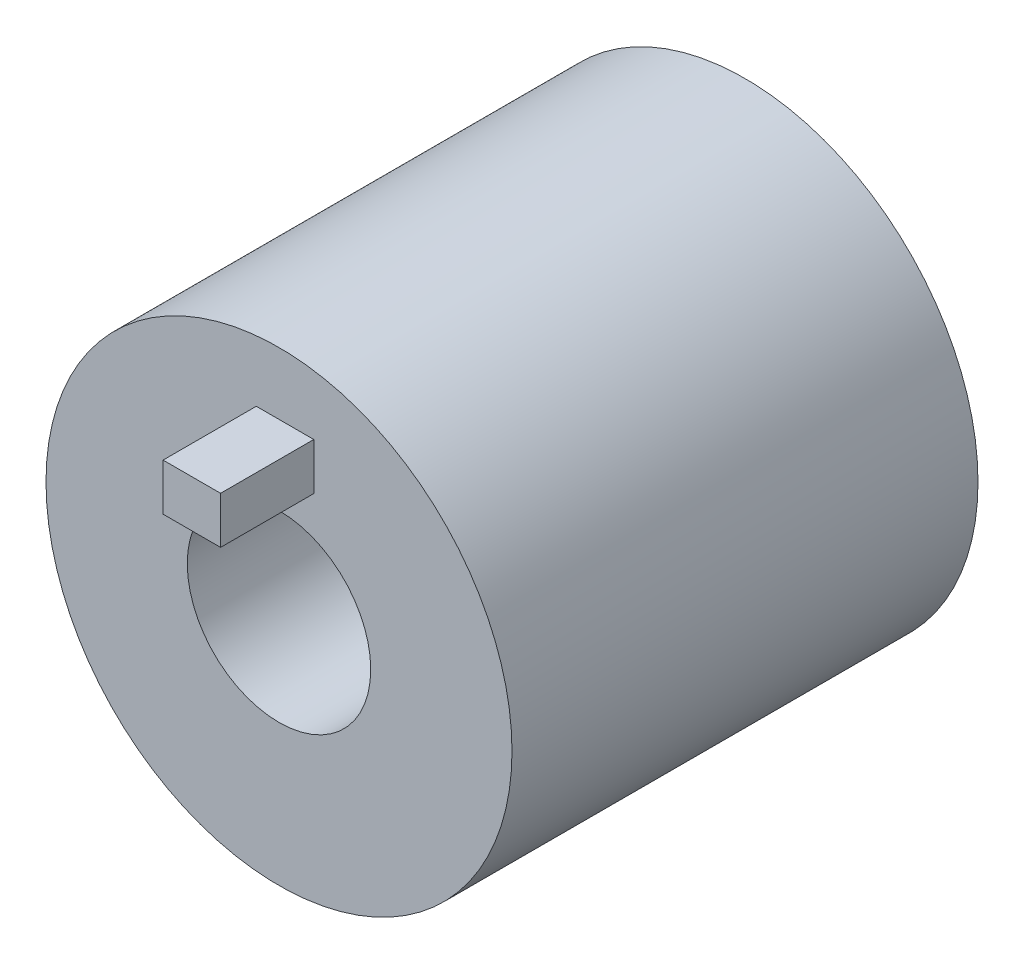
from build123d import *

# Parameters (mm, degrees)
SKETCH1_R           = 6.35
SKETCH1_R_2         = 2.499995
BOSS_EXTRUDE1_DEPTH = 12.7
SKETCH2_W           = 1.567050356
SKETCH2_H           = 1.276855845
BOSS_EXTRUDE2_DEPTH = 2.54


with BuildPart() as part:
    # Sketch1 → Boss-Extrude1 (new body)
    with BuildSketch(Plane.XY):
        Circle(SKETCH1_R)
        Circle(SKETCH1_R_2, mode=Mode.SUBTRACT)
    extrude(amount=BOSS_EXTRUDE1_DEPTH)

    # Sketch2 → Boss-Extrude2 (add)
    with BuildSketch(Plane.XY.offset(12.7)):
        with Locations((0.164443556, 4.014357393)):
            Rectangle(SKETCH2_W, SKETCH2_H)
    extrude(amount=BOSS_EXTRUDE2_DEPTH)


solid = part.part
